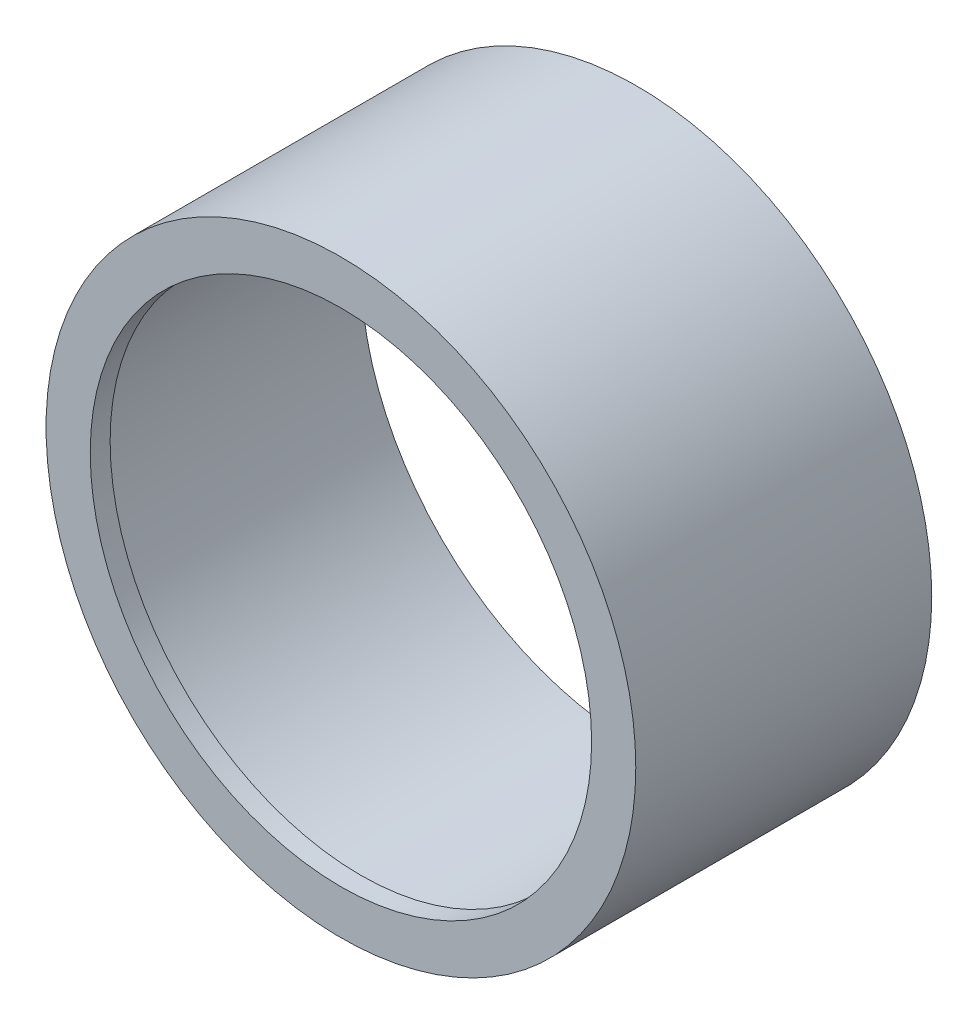
from build123d import *

# Parameters (mm, degrees)
SKETCH1_R           = 26.7
SKETCH1_R_2         = 25
BOSS_EXTRUDE1_DEPTH = 25
BOSS_EXTRUDE2_START = 1.8
SKETCH2_R           = 26.7
SKETCH2_R_2         = 22.7
BOSS_EXTRUDE2_DEPTH = 1.8


with BuildPart() as part:
    # Sketch1 → Boss-Extrude1 (new body)
    with BuildSketch(Plane.XY):
        Circle(SKETCH1_R)
        Circle(SKETCH1_R_2, mode=Mode.SUBTRACT)
    extrude(amount=-BOSS_EXTRUDE1_DEPTH)

    # Sketch2 → Boss-Extrude2 (add)
    with BuildSketch(Plane.XY.offset(BOSS_EXTRUDE2_START)):
        Circle(SKETCH2_R)
        Circle(SKETCH2_R_2, mode=Mode.SUBTRACT)
    extrude(amount=-BOSS_EXTRUDE2_DEPTH)


solid = part.part
